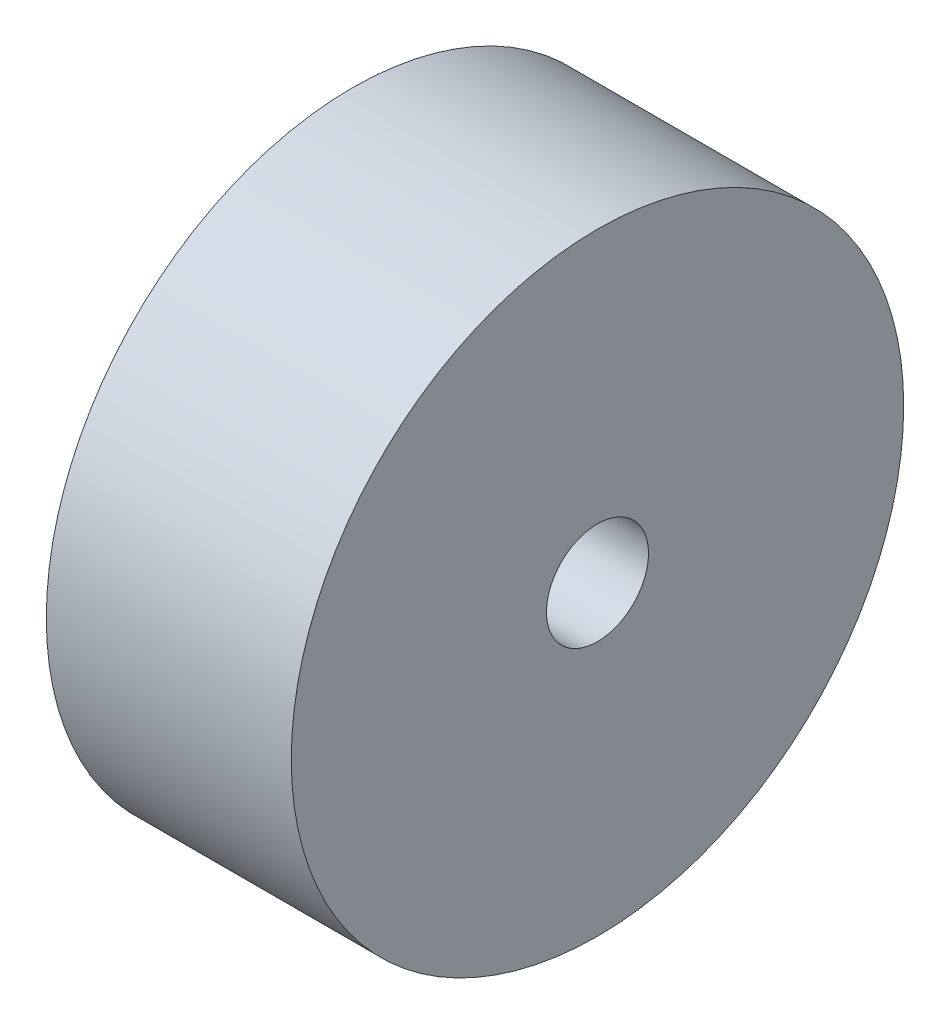
from build123d import *

# Parameters (mm, degrees)
SKETCH1_R           = 75
SKETCH1_R_2         = 12.5
BOSS_EXTRUDE1_DEPTH = 30


with BuildPart() as part:
    # Sketch1 → Boss-Extrude1 (new, symmetric)
    with BuildSketch(Plane(origin=(0, 0, 0), x_dir=(0, 0, -1), z_dir=(1, 0, 0))):
        Circle(SKETCH1_R)
        Circle(SKETCH1_R_2, mode=Mode.SUBTRACT)
    extrude(amount=BOSS_EXTRUDE1_DEPTH, both=True)


solid = part.part
